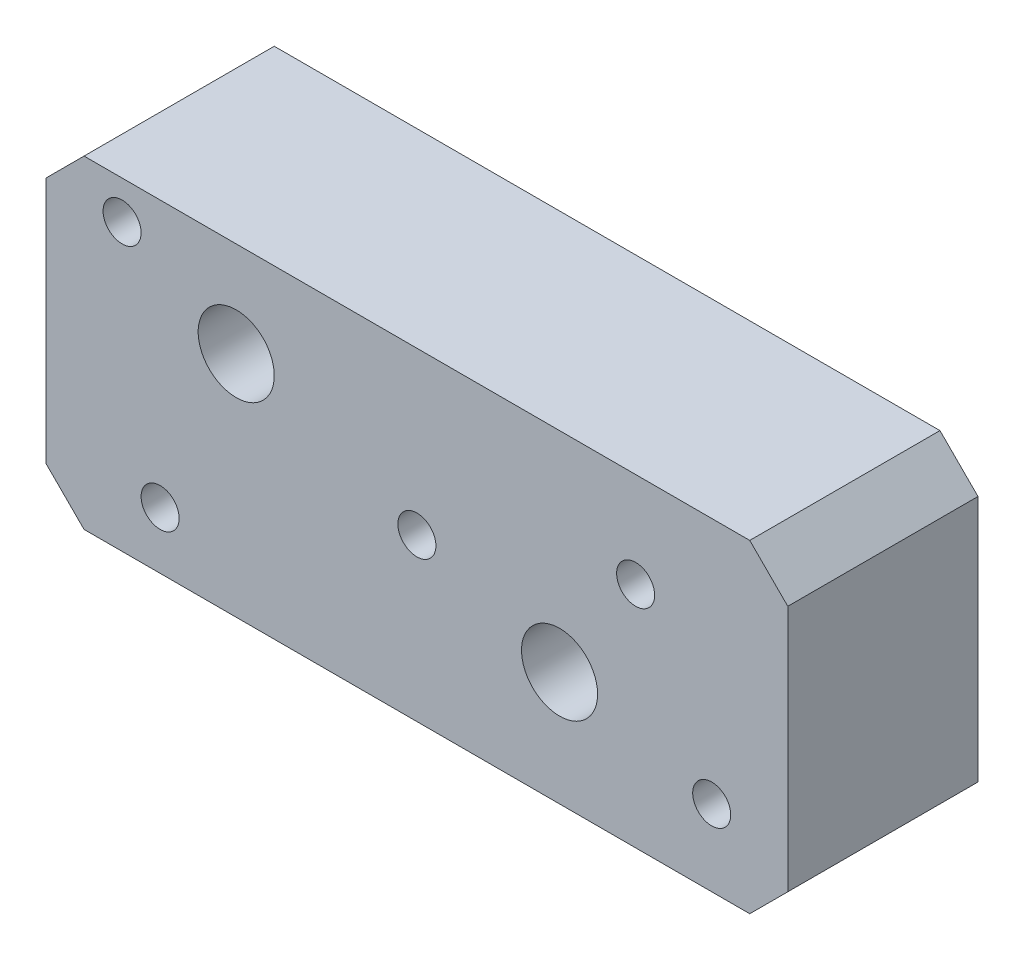
from build123d import *

# Parameters (mm, degrees)
SKETCH2_R           = 1
SKETCH2_R_2         = 2
BOSS_EXTRUDE1_DEPTH = 5


with BuildPart() as part:
    # Sketch2 → Boss-Extrude1 (new, symmetric)
    with BuildSketch(Plane.XY):
        Polygon((-17.5, 8.5), (-19.5, 6.5), (-19.5, -6.5), (-17.5, -8.5), (17.5, -8.5), (19.5, -6.5), (19.5, 6.5), (17.5, 8.5), align=None)
        Circle(SKETCH2_R, mode=Mode.SUBTRACT)
        with Locations((-13.5, -5.5)):
            Circle(SKETCH2_R, mode=Mode.SUBTRACT)
        with Locations((-15.5, 6.5)):
            Circle(SKETCH2_R, mode=Mode.SUBTRACT)
        with Locations((-9.5, 3.5)):
            Circle(SKETCH2_R_2, mode=Mode.SUBTRACT)
        with Locations((7.5, -2.5)):
            Circle(SKETCH2_R_2, mode=Mode.SUBTRACT)
        with Locations((15.5, -4.5)):
            Circle(SKETCH2_R, mode=Mode.SUBTRACT)
        with Locations((11.5, 3.5)):
            Circle(SKETCH2_R, mode=Mode.SUBTRACT)
    extrude(amount=BOSS_EXTRUDE1_DEPTH, both=True)


solid = part.part
